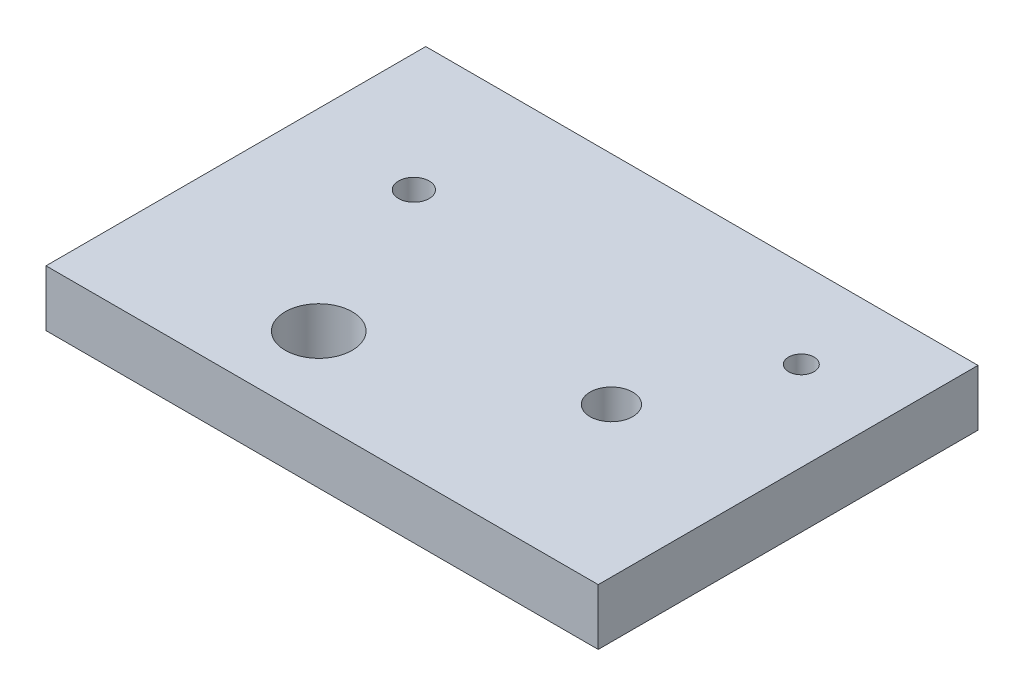
from build123d import *

# Parameters (mm, degrees)
SKETCH1_W           = 98.342676945
SKETCH1_H           = 67.629502453
SKETCH1_R           = 2.269446391
SKETCH1_R_2         = 3.798263555
SKETCH1_R_3         = 5.962307864
SKETCH1_R_4         = 2.723335669
BOSS_EXTRUDE1_DEPTH = 10


with BuildPart() as part:
    # Sketch1 → Boss-Extrude1 (new body)
    with BuildSketch(Plane(origin=(0, 0, 0), x_dir=(1, 0, 0), z_dir=(0, 1, 0))):
        with Locations((6.394656623, 4.841485635)):
            Rectangle(SKETCH1_W, SKETCH1_H)
        with Locations(Location((39.679870357, 23.072704975, 0), (0, 0, 270))):
            Circle(SKETCH1_R, mode=Mode.SUBTRACT)
        with Locations(Location((28.937824107, 0, 0), (0, 0, 270))):
            Circle(SKETCH1_R_2, mode=Mode.SUBTRACT)
        with Locations(Location((-8.432393132, -14.751401542, 0), (0, 0, 270))):
            Circle(SKETCH1_R_3, mode=Mode.SUBTRACT)
        with Locations(Location((-21.746478626, 15.507883672, 0), (0, 0, 270))):
            Circle(SKETCH1_R_4, mode=Mode.SUBTRACT)
    extrude(amount=BOSS_EXTRUDE1_DEPTH)


solid = part.part
